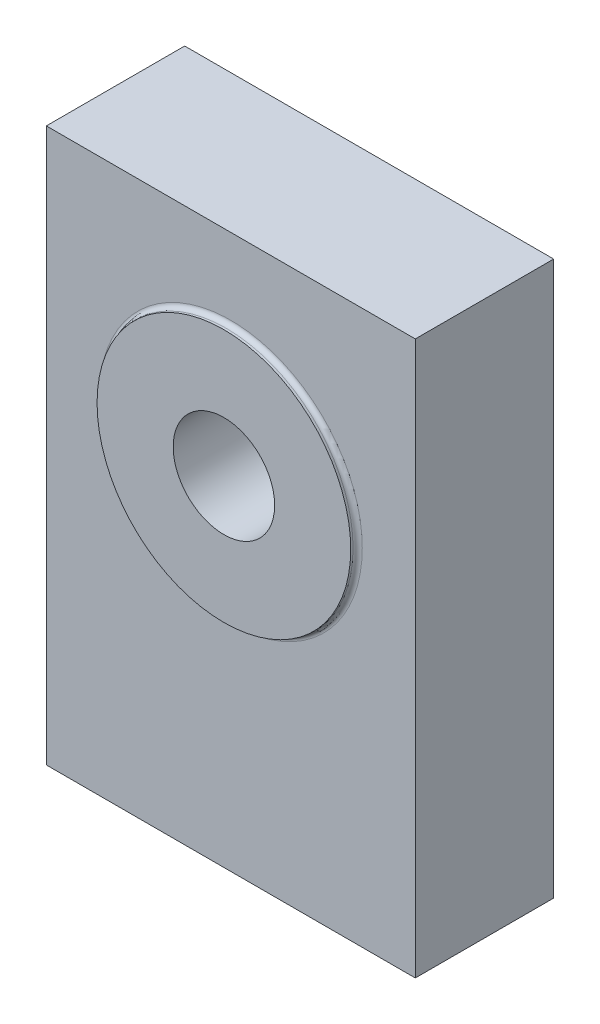
from build123d import *

# Parameters (mm, degrees)
SKETCH_1_W          = 80
SKETCH_1_H          = 30
EXTRUDE_1_DEPTH     = 120
SKETCH_2_R          = 27.5
EXTRUDE_2_DEPTH     = 1.5
SKETCH_3_R          = 11
CUT_EXTRUDE_1_DEPTH = 39.5
FILLET_1_R          = 1


with BuildPart() as part:
    # 草图1 → 凸台-拉伸1 (new body)
    with BuildSketch(Plane(origin=(0, 0, 0), x_dir=(1, 0, 0), z_dir=(0, 1, 0))):
        Rectangle(SKETCH_1_W, SKETCH_1_H)
    extrude(amount=EXTRUDE_1_DEPTH)

    # 草图2 → 凸台-拉伸2 (add)
    with BuildSketch(Plane.XY.offset(15)):
        with Locations(Location((0, 75, 0), (0, 0, 180))):
            Circle(SKETCH_2_R)
    extrude(amount=EXTRUDE_2_DEPTH)

    # 草图3 → 切除-拉伸1 (cut)
    with BuildSketch(Plane.XY.offset(16.5)):
        with Locations((0, 75)):
            Circle(SKETCH_3_R)
    extrude(amount=-CUT_EXTRUDE_1_DEPTH, mode=Mode.SUBTRACT)

    # 圆角1
    fillet_1_edges = [part.edges().sort_by_distance(p)[0] for p in [
        (27.5, 75, 15),
    ]]
    fillet(fillet_1_edges, radius=FILLET_1_R)


solid = part.part
